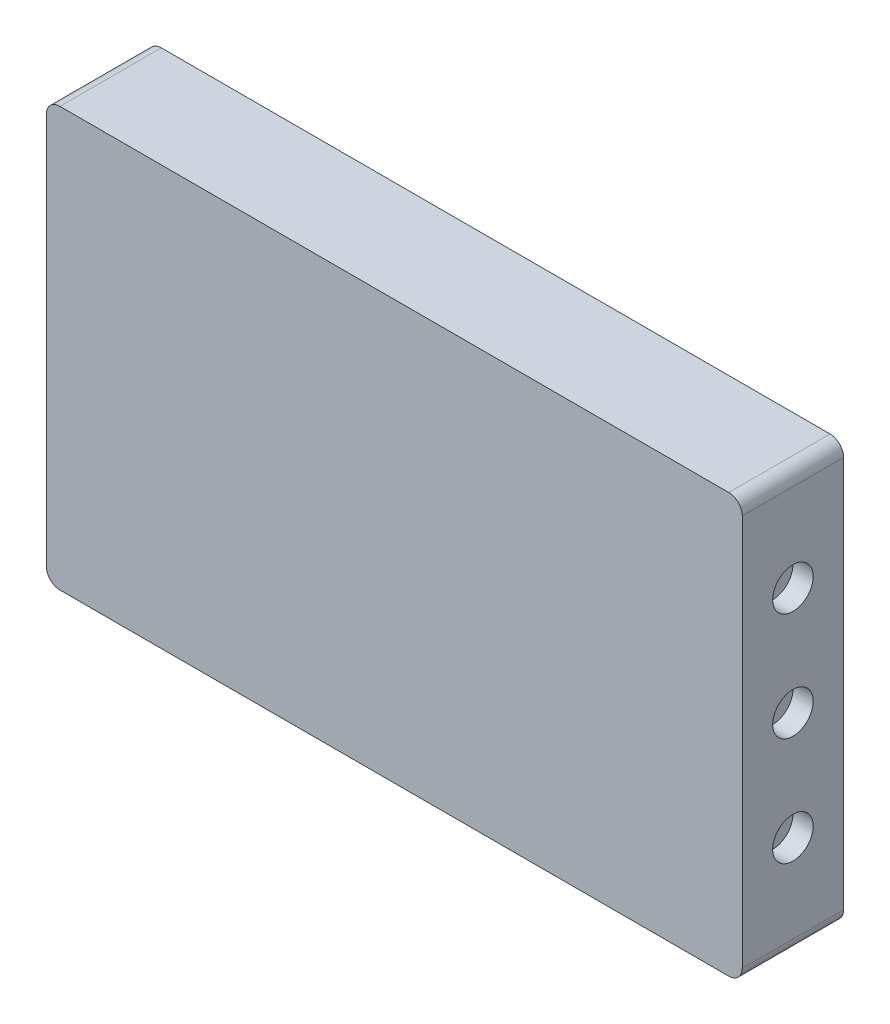
from build123d import *

# Parameters (mm, degrees)
SKETCH_1_W          = 103
SKETCH_1_H          = 62
EXTRUDE_1_DEPTH     = 15
FILLET_1_R          = 2
SKETCH_2_R          = 3
CUT_EXTRUDE_1_DEPTH = 3


with BuildPart() as part:
    # 草图1 → 凸台-拉伸1 (new body)
    with BuildSketch(Plane.XY):
        Rectangle(SKETCH_1_W, SKETCH_1_H)
    extrude(amount=EXTRUDE_1_DEPTH)

    # 圆角1
    fillet_1_edges = [part.edges().sort_by_distance(p)[0] for p in [
        (51.5, -31, 7.5),
        (-51.5, -31, 7.5),
        (-51.5, 31, 7.5),
        (51.5, 31, 7.5),
    ]]
    fillet(fillet_1_edges, radius=FILLET_1_R)

    # 草图2 → 切除-拉伸1 (cut)
    with BuildSketch(Plane(origin=(51.5, 0, 0), x_dir=(0, 0, -1), z_dir=(1, 0, 0))):
        with Locations((-7.5, 0)):
            Circle(SKETCH_2_R)
        with Locations((-7.5, 16)):
            Circle(SKETCH_2_R)
        with Locations((-7.5, -16)):
            Circle(SKETCH_2_R)
    extrude(amount=-CUT_EXTRUDE_1_DEPTH, mode=Mode.SUBTRACT)


solid = part.part
